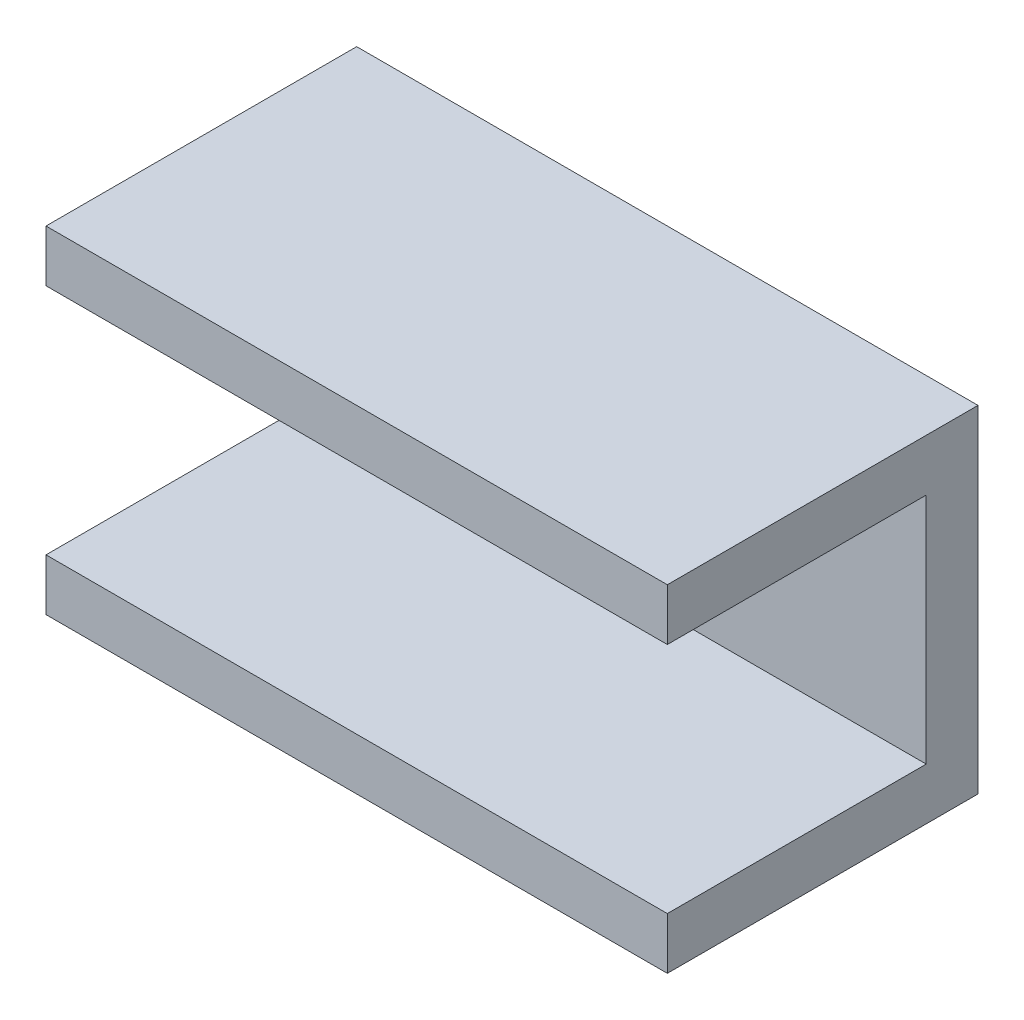
from build123d import *

# Parameters (mm, degrees)
BOSS_EXTRUDE2_DEPTH = 76.2


with BuildPart() as part:
    # Sketch4 → Boss-Extrude2 (new body)
    with BuildSketch(Plane(origin=(0, 0, 0), x_dir=(0, 0, -1), z_dir=(1, 0, 0))):
        Polygon((0, 0), (0, 20.6375), (-38.1, 20.6375), (-38.1, 14.2875), (-6.35, 14.2875), (-6.35, 0), align=None)
        Polygon((0, -20.6375), (0, 0), (-6.35, 0), (-6.35, -14.2875), (-38.1, -14.2875), (-38.1, -20.6375), align=None)
    extrude(amount=BOSS_EXTRUDE2_DEPTH)


solid = part.part
